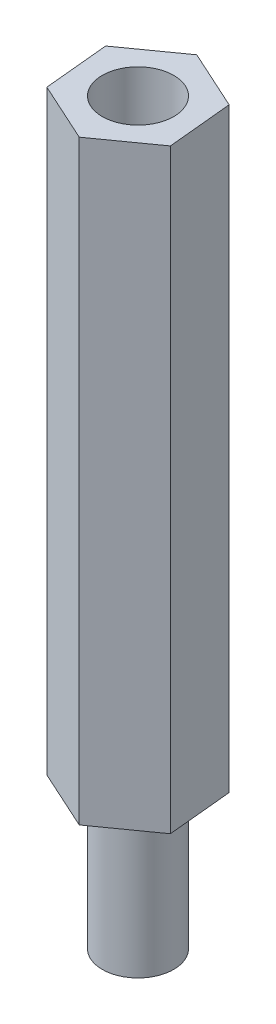
from build123d import *

# Parameters (mm, degrees)
SKETCH_1_R          = 1.5
EXTRUDE_1_DEPTH     = 6
EXTRUDE_2_DEPTH     = 25
CUT_EXTRUDE_START   = -5
SKETCH_3_R          = 1.5
CUT_EXTRUDE_1_DEPTH = 5


with BuildPart() as part:
    # 草图1 → 凸台-拉伸1 (new body)
    with BuildSketch(Plane(origin=(0, 0, 0), x_dir=(1, 0, 0), z_dir=(0, 1, 0))):
        with Locations(Location((0, 0, 0), (0, 0, 270))):
            Circle(SKETCH_1_R)
    extrude(amount=EXTRUDE_1_DEPTH)

    # 草图2 → 凸台-拉伸2 (add)
    with BuildSketch(Plane(origin=(0, 6, 0), x_dir=(1, 0, 0), z_dir=(0, 1, 0))):
        Polygon((2.495784313, -1.136615149), (2.23222975, 1.593105043), (-0.263554563, 2.729720192), (-2.495784313, 1.136615149), (-2.23222975, -1.593105043), (0.263554563, -2.729720192), align=None)
    extrude(amount=EXTRUDE_2_DEPTH)

    # 草图3 → 切除-拉伸1 (cut)
    with BuildSketch(Plane(origin=(0, 31, 0), x_dir=(1, 0, 0), z_dir=(0, 1, 0)).offset(CUT_EXTRUDE_START)):
        with Locations(Location((0, 0, 0), (0, 0, 270))):
            Circle(SKETCH_3_R)
    extrude(amount=CUT_EXTRUDE_1_DEPTH, mode=Mode.SUBTRACT)


solid = part.part
